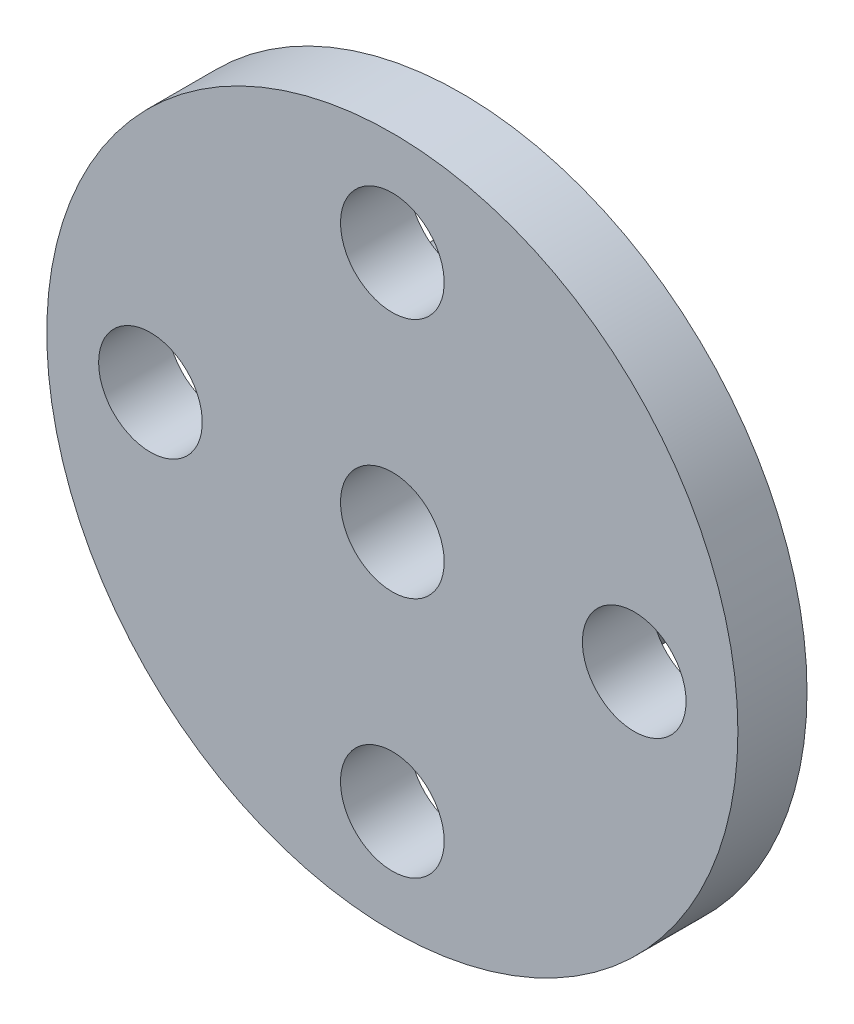
from build123d import *
from build123d.topology import SkipClean

# Parameters (mm, degrees)
ESQUISSE1_R        = 10
ESQUISSE1_R_2      = 1.5
BOSS_EXTRU_1_DEPTH = 2
BOSS_EXTRU_2_START = 3.5
ESQUISSE2_R        = 4.75
ESQUISSE2_R_2      = 1.5
BOSS_EXTRU_2_DEPTH = 3.5


with BuildPart() as part:
    # Esquisse1 → Boss.-Extru.1 (new body)
    with BuildSketch(Plane.XY):
        Circle(ESQUISSE1_R)
        with Locations((7, 0)):
            Circle(ESQUISSE1_R_2, mode=Mode.SUBTRACT)
        with Locations(Location((0, 7, 0), (0, 0, 180))):
            Circle(ESQUISSE1_R_2, mode=Mode.SUBTRACT)
        Circle(ESQUISSE1_R_2, mode=Mode.SUBTRACT)
        with Locations((0, -7)):
            Circle(ESQUISSE1_R_2, mode=Mode.SUBTRACT)
        with Locations(Location((-7, 0, 0), (0, 0, 180))):
            Circle(ESQUISSE1_R_2, mode=Mode.SUBTRACT)
    extrude(amount=BOSS_EXTRU_1_DEPTH)

    # Esquisse2 → Boss.-Extru.2 (add)
    with SkipClean():  # the faces are left unmerged after this step: merging them gives an invalid solid
        with BuildSketch(Plane(origin=(0, 0, 0), x_dir=(-1, 0, 0), z_dir=(0, 0, -1)).offset(BOSS_EXTRU_2_START)):
            with Locations(Location((0, 0, 0), (0, 0, 180))):
                Circle(ESQUISSE2_R)
            Circle(ESQUISSE2_R_2, mode=Mode.SUBTRACT)
        extrude(amount=-BOSS_EXTRU_2_DEPTH)


solid = part.part
